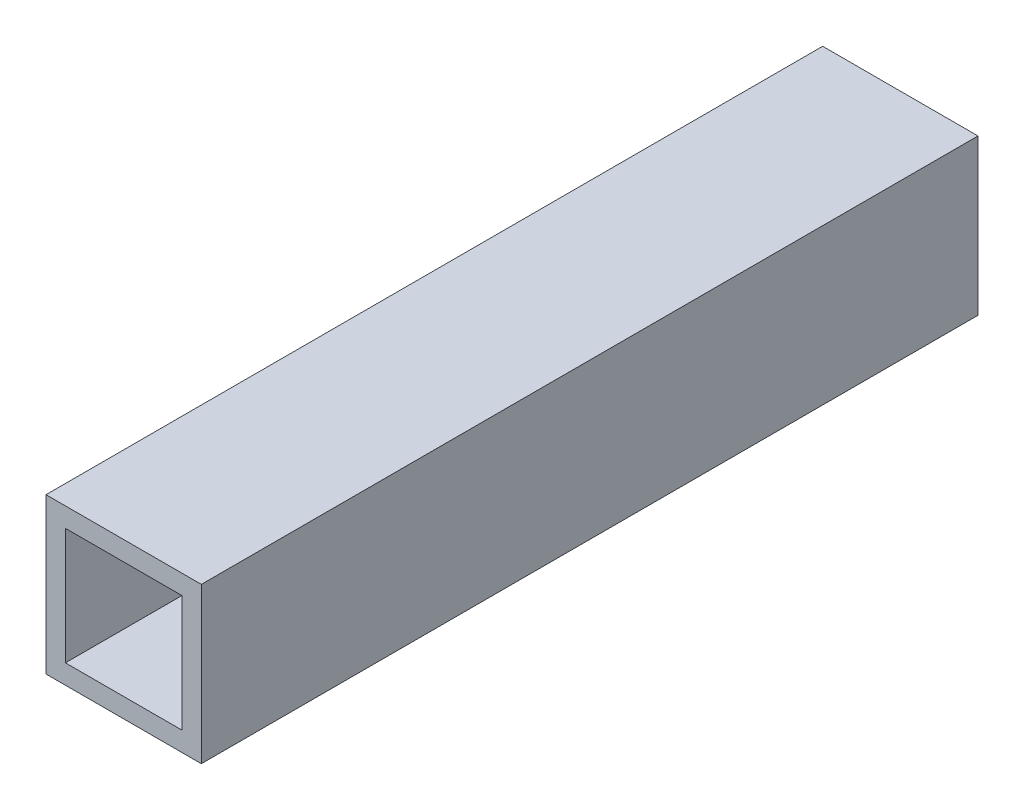
from build123d import *

# Parameters (mm, degrees)
SKETCH2_W           = 25.4
SKETCH2_H           = 25.4
SKETCH2_W_2         = 19.05
SKETCH2_H_2         = 19.05
BOSS_EXTRUDE1_DEPTH = 127


with BuildPart() as part:
    # Sketch2 → Boss-Extrude1 (new body)
    with BuildSketch(Plane.XY):
        Rectangle(SKETCH2_W, SKETCH2_H)
        Rectangle(SKETCH2_W_2, SKETCH2_H_2, mode=Mode.SUBTRACT)
    extrude(amount=BOSS_EXTRUDE1_DEPTH)


solid = part.part
